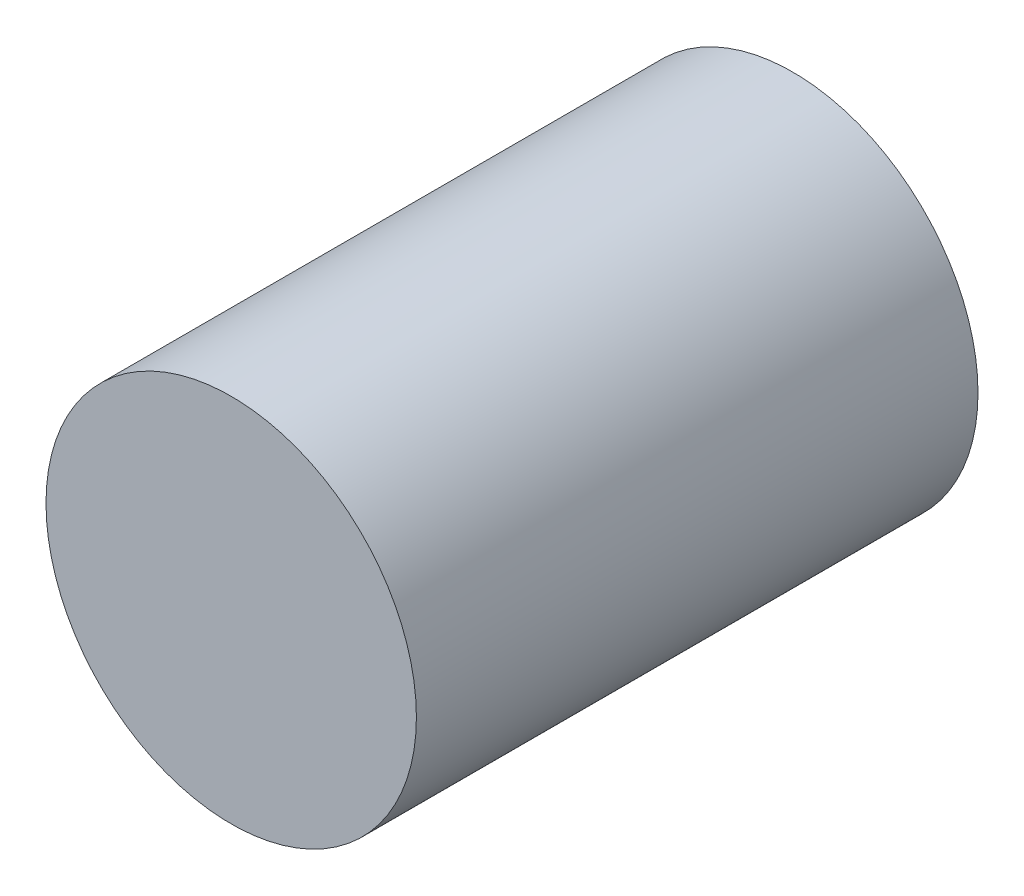
from build123d import *

# Parameters (mm, degrees)
SKETCH1_R           = 3.1
BOSS_EXTRUDE1_DEPTH = 9.4


with BuildPart() as part:
    # Sketch1 → Boss-Extrude1 (new body)
    with BuildSketch(Plane.XY):
        Circle(SKETCH1_R)
    extrude(amount=BOSS_EXTRUDE1_DEPTH)


solid = part.part
